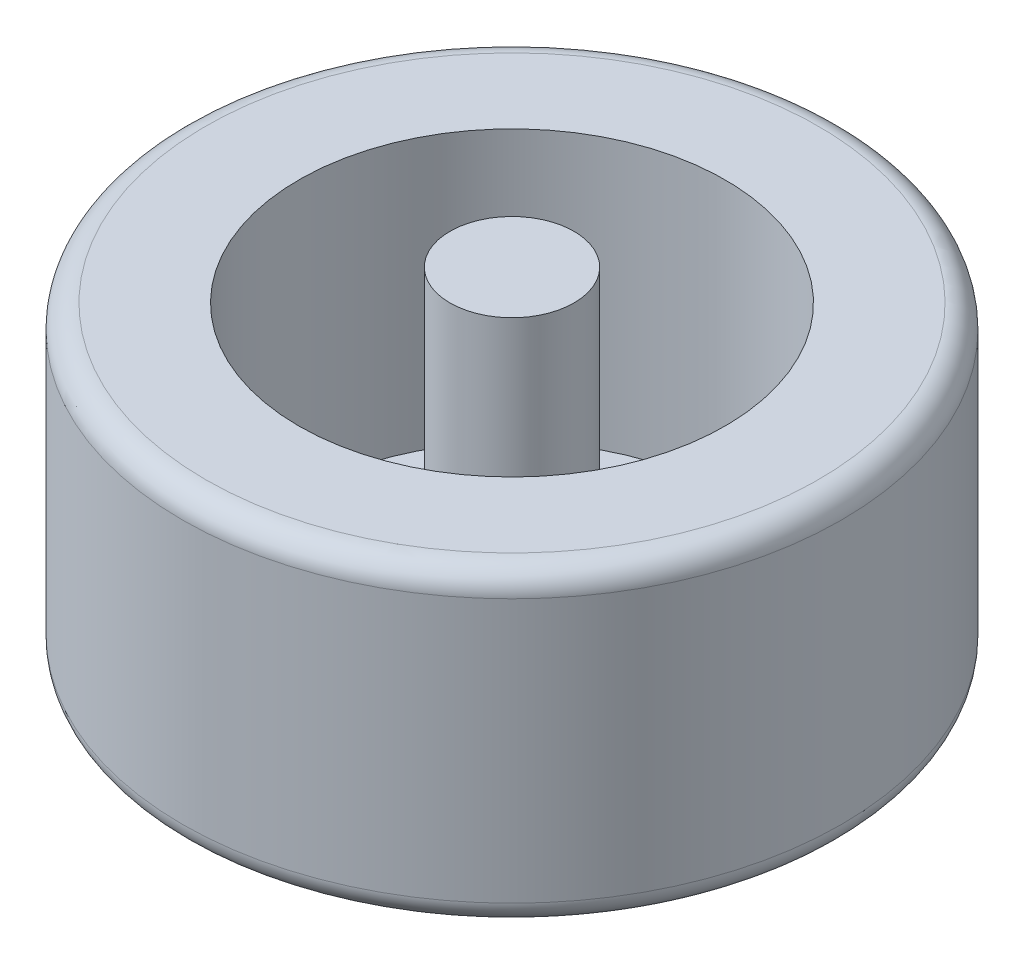
from build123d import *

# Parameters (mm, degrees)
SKETCH_1_R               = 42.5
EXTRUDE_1_DEPTH          = 40
SKETCH_2_R               = 27.5
SKETCH_2_R_2             = 8
CUT_EXTRUDE_1_DEPTH      = 35
SKETCH_3_R               = 4
CUT_EXTRUDE_2_DEPTH      = 35
PATTERN_CIRCULAR_1_COUNT = 8
CUT_EXTRUDE_START        = -2
SKETCH_4_R               = 27.5
CUT_EXTRUDE_3_DEPTH      = 2
EXTRUDE_START            = 4
SKETCH_5_R               = 8
EXTRUDE_2_DEPTH          = 4
FILLET_1_R               = 3


with BuildPart() as part:
    # Эскиз1 → Бобышка-Вытянуть1 (new body)
    with BuildSketch(Plane(origin=(0, 0, 0), x_dir=(1, 0, 0), z_dir=(0, 1, 0))):
        with Locations(Location((0, 0, 0), (0, 0, 270))):
            Circle(SKETCH_1_R)
    extrude(amount=EXTRUDE_1_DEPTH)

    # Эскиз2 → Вырез-Вытянуть1 (cut)
    with BuildSketch(Plane(origin=(0, 40, 0), x_dir=(1, 0, 0), z_dir=(0, 1, 0))):
        with Locations(Location((0, 0, 0), (0, 0, 270))):
            Circle(SKETCH_2_R)
        with Locations(Location((0, 0, 0), (0, 0, 270))):
            Circle(SKETCH_2_R_2, mode=Mode.SUBTRACT)
    extrude(amount=-CUT_EXTRUDE_1_DEPTH, mode=Mode.SUBTRACT)

    # Эскиз3 → Вырез-Вытянуть2 (cut)
    with BuildSketch(Plane(origin=(0, 5, 0), x_dir=(1, 0, 0), z_dir=(0, 1, 0))):
        with Locations(Location((0, 17.75, 0), (0, 0, 270))):
            Circle(SKETCH_3_R)
    cut_extrude_2 = extrude(amount=-CUT_EXTRUDE_2_DEPTH, mode=Mode.SUBTRACT)

    # Круговой массив1: Вырез-Вытянуть2 ×8 about axis
    pattern_circular_1_axis = Axis((0, 0, 0), (0, 1, 0))
    for i in range(1, PATTERN_CIRCULAR_1_COUNT):
        add(cut_extrude_2.rotate(pattern_circular_1_axis, i * 360 / PATTERN_CIRCULAR_1_COUNT), mode=Mode.SUBTRACT)

    # Эскиз4 → Вырез-Вытянуть3 (cut)
    with BuildSketch(Plane.XZ.offset(CUT_EXTRUDE_START)):
        with Locations(Location((0, 0, 0), (0, 0, 90))):
            Circle(SKETCH_4_R)
    extrude(amount=CUT_EXTRUDE_3_DEPTH, mode=Mode.SUBTRACT)

    # Эскиз5 → Бобышка-Вытянуть2 (add)
    with BuildSketch(Plane(origin=(0, 40, 0), x_dir=(1, 0, 0), z_dir=(0, 1, 0)).offset(EXTRUDE_START)):
        with Locations(Location((0, 0, 0), (0, 0, 270))):
            Circle(SKETCH_5_R)
    extrude(amount=-EXTRUDE_2_DEPTH)

    # Скругление1
    fillet_1_edges = [part.edges().sort_by_distance(p)[0] for p in [
        (0, 0, -42.5),
        (0, 40, -42.5),
    ]]
    fillet(fillet_1_edges, radius=FILLET_1_R)


solid = part.part
